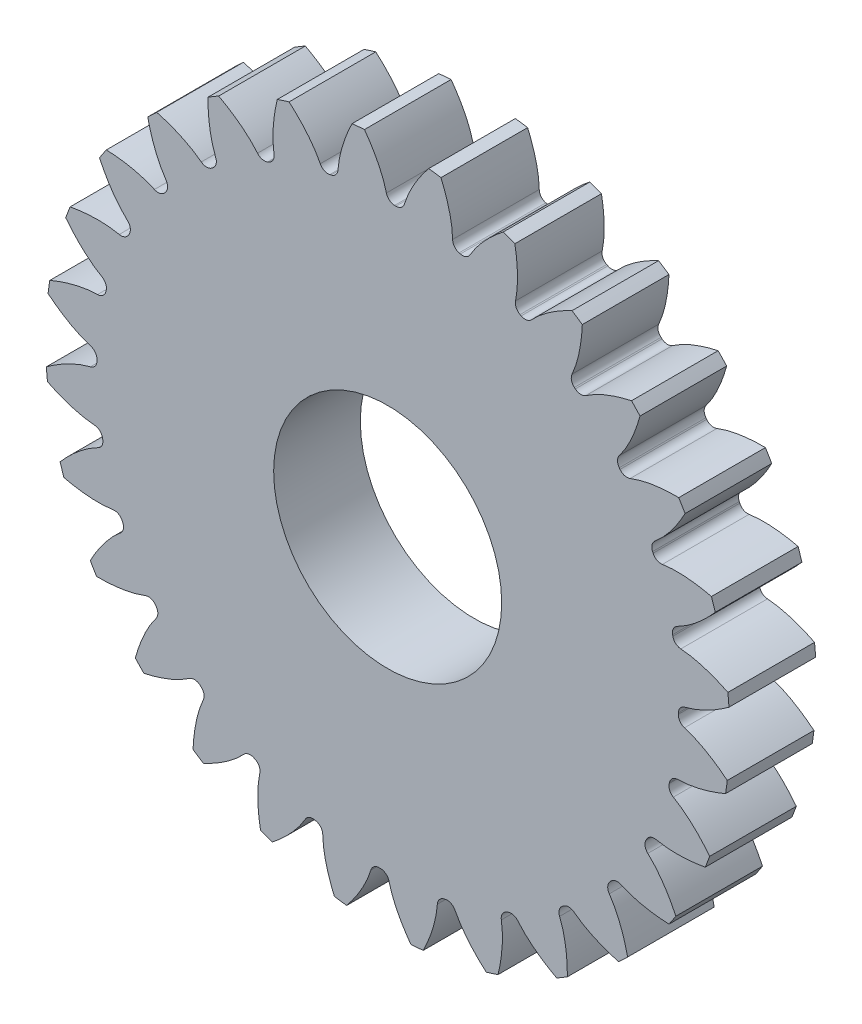
from build123d import *

# Parameters (mm, degrees)
SKETCH3_R           = 6.375
BOSS_EXTRUDE1_DEPTH = 1.9
BOSS_EXTRUDE2_DEPTH = 1.9
CIRPATTERN1_COUNT   = 28
SKETCH4_R           = 2.5
CUT_EXTRUDE1_DEPTH  = 11.751335276


with BuildPart() as part:
    # Sketch3 → Boss-Extrude1 (new body)
    with BuildSketch(Plane.XY):
        with Locations(Location((0, 0, 0), (0, 0, 180))):
            Circle(SKETCH3_R)
    extrude(amount=BOSS_EXTRUDE1_DEPTH)

    # Sketch3<3> → Boss-Extrude2 (add)
    with BuildSketch(Plane.XY):
        with BuildLine():
            add(Edge.make_bspline(
                [(6.518660676, 0.027710634), (6.538150793, 0.032401716), (6.571812289, 0.041139147), (6.619378779, 0.054906868), (6.680418801, 0.074863098), (6.735888675, 0.09475549), (6.790784479, 0.116039939), (6.856816738, 0.143544445), (6.935326221, 0.178912523), (7.026017493, 0.223691424), (7.127531708, 0.278508375), (7.229419189, 0.338620177), (7.328339691, 0.401238989), (7.404439011, 0.453259268), (7.454363251, 0.488700567), (7.480381944, 0.507629373), (7.482686912, 0.509309906)],
                knots=[0.08222001, 0.08222001, 0.08222001, 0.08222001, 0.08222001, 0.119476176, 0.146842496, 0.174208854, 0.201574956, 0.228941013, 0.256307345, 0.307035032, 0.361767352, 0.416499661, 0.471231936, 0.525964282, 0.580696615, 0.586018142, 0.586018142, 0.586018142, 0.586018142, 0.586018142], degree=4))
            ThreePointArc((7.482686912, 0.509309906), (7.472232973, 0.644774687), (7.459326815, 0.780027867))
            add(Edge.make_bspline(
                [(6.427050926, 1.089367376), (6.447056545, 1.088084359), (6.481717219, 1.085242409), (6.530939053, 1.079826497), (6.594495372, 1.070621613), (6.652552941, 1.060525439), (6.710283391, 1.048959444), (6.780051198, 1.033173048), (6.86345885, 1.011776707), (6.960480329, 0.983195431), (7.069884322, 0.946578491), (7.180563089, 0.904808908), (7.288748194, 0.86006112), (7.372633886, 0.821845856), (7.427891376, 0.795480628), (7.456768037, 0.78128871), (7.459326815, 0.780027867)],
                knots=[0.08222001, 0.08222001, 0.08222001, 0.08222001, 0.08222001, 0.119476176, 0.146842496, 0.174208854, 0.201574956, 0.228941013, 0.256307345, 0.307035032, 0.361767352, 0.416499661, 0.471231936, 0.525964282, 0.580696615, 0.586018142, 0.586018142, 0.586018142, 0.586018142, 0.586018142], degree=4))
            ThreePointArc((6.427050926, 1.089367376), (6.314015974, 1.136057725), (6.252851684, 1.241962488))
            ThreePointArc((6.252851684, 1.241962488), (6.34438943, 0.62397737), (6.375, 0))
            ThreePointArc((6.375, 0), (6.374544094, -0.076240342), (6.373176442, -0.15246978))
            ThreePointArc((6.373176442, -0.15246978), (6.415294782, -0.037652819), (6.518660676, 0.027710634))
        make_face()
    boss_extrude2 = extrude(amount=BOSS_EXTRUDE2_DEPTH)

    # CirPattern1: Boss-Extrude2 ×28 about axis
    cirpattern1_axis = Axis((0, 0, 1.9), (0, 0, -1))
    for i in range(1, CIRPATTERN1_COUNT):
        add(boss_extrude2.rotate(cirpattern1_axis, i * 360 / CIRPATTERN1_COUNT))

    # Sketch4 → Cut-Extrude1 (cut, through all)
    with BuildSketch(Plane.XY.offset(1.9)):
        Circle(SKETCH4_R)
    extrude(amount=-CUT_EXTRUDE1_DEPTH, mode=Mode.SUBTRACT)


solid = part.part
